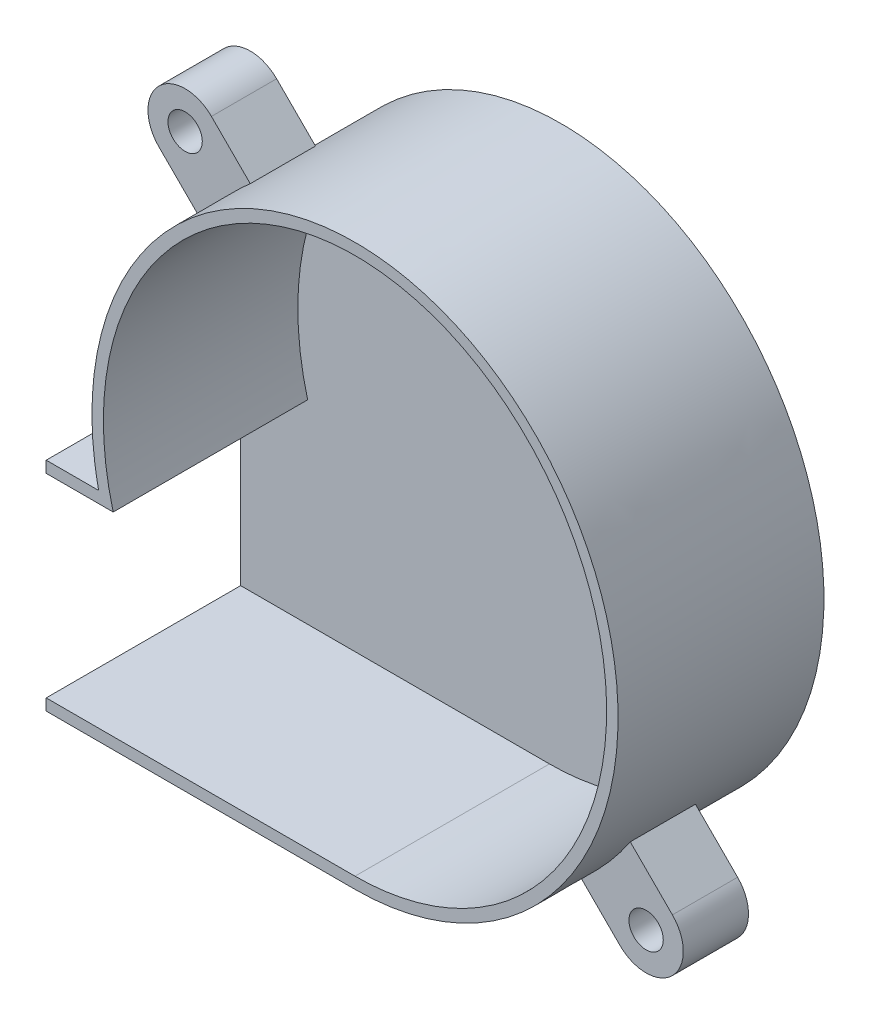
from build123d import *

# Parameters (mm, degrees)
RESSALTO_EXTRUS_O1_DEPTH = 1
RESSALTO_EXTRUS_O2_DEPTH = 18
RESSALTO_EXTRUS_O3_START = 7
ESBO_O2_R                = 1.5
RESSALTO_EXTRUS_O3_DEPTH = 5.7


with BuildPart() as part:
    # Esboço1 → Ressalto-extrusão1 (new body)
    with BuildSketch(Plane.XY):
        with BuildLine():
            Line((0, -24.5), (-27, -24.5))
            Line((-27, -24.5), (-27, -5.5))
            Line((-27, -5.5), (-22.412958113, -5.5))
            add(Edge.make_bspline(
                [(0, -24.5), (65.836852825, -24.5), (14.322096529, 19.170289513), (-37.192659768, 62.840579025), (-22.412958113, -5.5)],
                knots=[3.141592654, 3.141592654, 3.141592654, 5.610996862, 5.610996862, 8.080401071, 8.080401071, 8.080401071], degree=2, weights=[1, 0.329802368, 1, 0.329802368, 1]))
        make_face()
    extrude(amount=RESSALTO_EXTRUS_O1_DEPTH)

    # Esboço1<3> → Ressalto-extrusão2 (add)
    with BuildSketch(Plane.XY):
        with BuildLine():
            Line((-27, -24.5), (0, -24.5))
            add(Edge.make_bspline(
                [(0, -24.5), (65.836852825, -24.5), (14.322096529, 19.170289513), (-37.192659768, 62.840579025), (-22.412958113, -5.5)],
                knots=[3.141592654, 3.141592654, 3.141592654, 5.610996862, 5.610996862, 8.080401071, 8.080401071, 8.080401071], degree=2, weights=[1, 0.329802368, 1, 0.329802368, 1]))
            Line((-22.412958113, -5.5), (-27, -5.5))
            Line((-27, -5.5), (-27, -6.5))
            Line((-27, -6.5), (-26, -6.5))
            Line((-26, -6.5), (-21.141556032, -6.5))
            add(Edge.make_bspline(
                [(-21.141556032, -6.5), (-21.775904085, -4.146166632), (-22.350046066, 0.776913351), (-21.041148584, 8.085534263), (-17.693740565, 14.60325148), (-12.642011321, 19.698901502), (-6.382550613, 22.888421504), (0.481967819, 23.87642002), (7.300930311, 22.573109993), (13.42716626, 19.097124393), (18.269121458, 13.771519703), (21.349583792, 7.103813932), (22.360588572, -0.259019098), (21.200301949, -7.596472965), (17.985787778, -14.190737202), (13.037013627, -19.402563883), (6.845518309, -22.73606338), (2.276344903, -23.5), (0, -23.5)],
                knots=[-3.141592654, -3.141592654, -3.141592654, -3.141592654, -2.829596215, -2.517599777, -2.205603339, -1.893606901, -1.581610462, -1.269614024, -0.957617586, -0.645621148, -0.333624709, -0.021628271, 0.290368167, 0.602364606, 0.914361044, 1.226357482, 1.53835392, 1.850350359, 1.850350359, 1.850350359, 1.850350359], degree=3))
            Line((0, -23.5), (-26, -23.5))
            Line((-26, -23.5), (-27, -23.5))
            Line((-27, -23.5), (-27, -24.5))
        make_face()
    extrude(amount=RESSALTO_EXTRUS_O2_DEPTH)

    # Esboço2 → Ressalto-extrusão3 (add)
    # profile 1 of 2: a face of its own
    with BuildSketch(Plane.XY.offset(RESSALTO_EXTRUS_O3_START)):
        with BuildLine():
            Line((22.450640303, -17.854446225), (18.764191202, -14.167997125))
            add(Edge.make_bspline(
                [(14.457993873, -19.054187951), (16.927761984, -16.927761984), (18.764191202, -14.167997125)],
                knots=[3.821355278, 3.821355278, 3.821355278, 4.095763269, 4.095763269, 4.095763269], degree=2, weights=[1, 0.990602288, 1]))
            Line((14.457993873, -19.054187951), (17.854446225, -22.450640303))
            ThreePointArc((17.854446225, -22.450640303), (22.450640303, -22.450640303), (22.450640303, -17.854446225))
        make_face()
        with Locations((20.152543264, -20.152543264)):
            Circle(ESBO_O2_R, mode=Mode.SUBTRACT)
    # profile 2 of 2: a face of its own
    with BuildSketch(Plane.XY.offset(RESSALTO_EXTRUS_O3_START)):
        with BuildLine():
            Line((-14.457993873, 19.054187951), (-17.854446225, 22.450640303))
            ThreePointArc((-17.854446225, 22.450640303), (-22.450640303, 22.450640303), (-22.450640303, 17.854446225))
            Line((-22.450640303, 17.854446225), (-18.764191202, 14.167997125))
            add(Edge.make_bspline(
                [(-14.457993873, 19.054187951), (-16.927761984, 16.927761984), (-18.764191202, 14.167997125)],
                knots=[0.679762624, 0.679762624, 0.679762624, 0.954170616, 0.954170616, 0.954170616], degree=2, weights=[1, 0.990602288, 1]))
        make_face()
        with Locations((-20.152543264, 20.152543264)):
            Circle(ESBO_O2_R, mode=Mode.SUBTRACT)
    extrude(amount=RESSALTO_EXTRUS_O3_DEPTH)


solid = part.part
